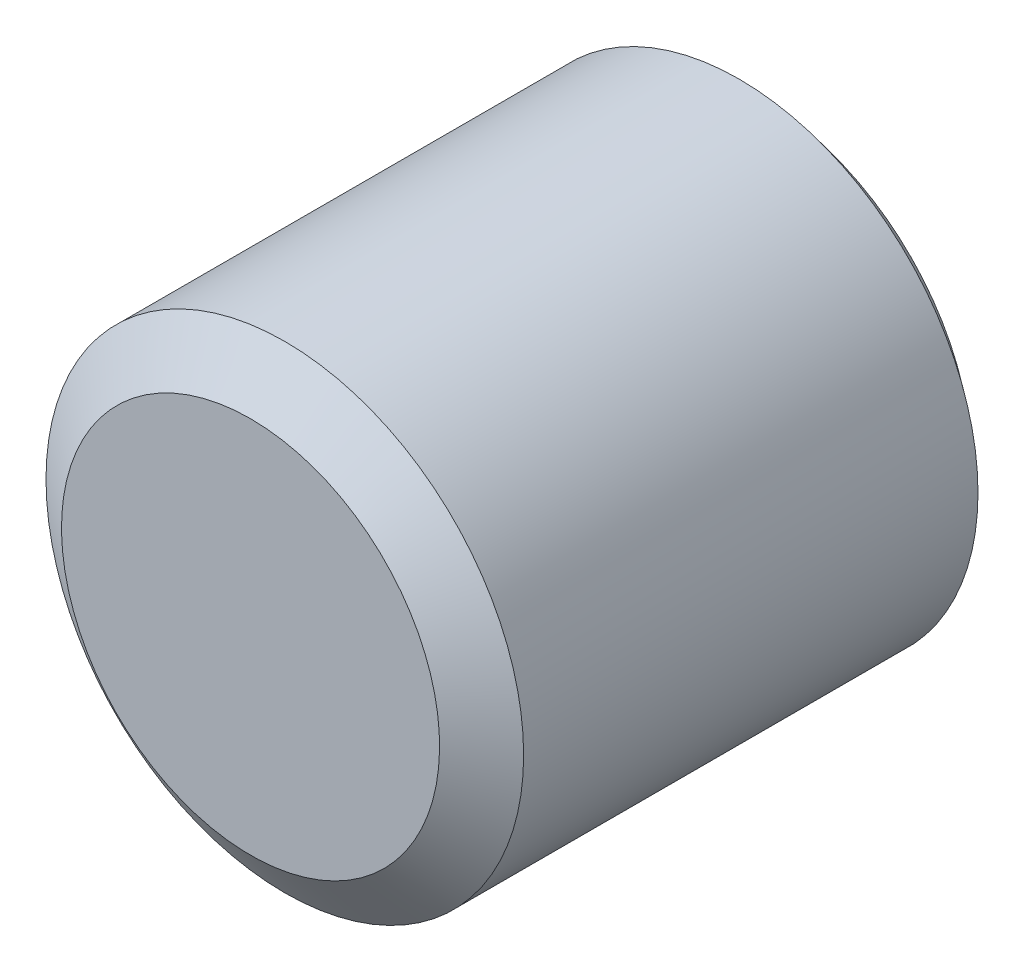
from build123d import *


with BuildPart() as part:
    # Sketch1 → Revolve1 (revolve)
    with BuildSketch(Plane(origin=(0, 0, 0), x_dir=(0, 0, -1), z_dir=(1, 0, 0))):
        Polygon((0, 0), (0, 11.081612586), (2.009832842, 14), (28.645051969, 14), (30, 12.276066184), (30, 0), align=None)
    revolve(axis=Axis((0, 0, -30), (0, 0, 1)))


solid = part.part
